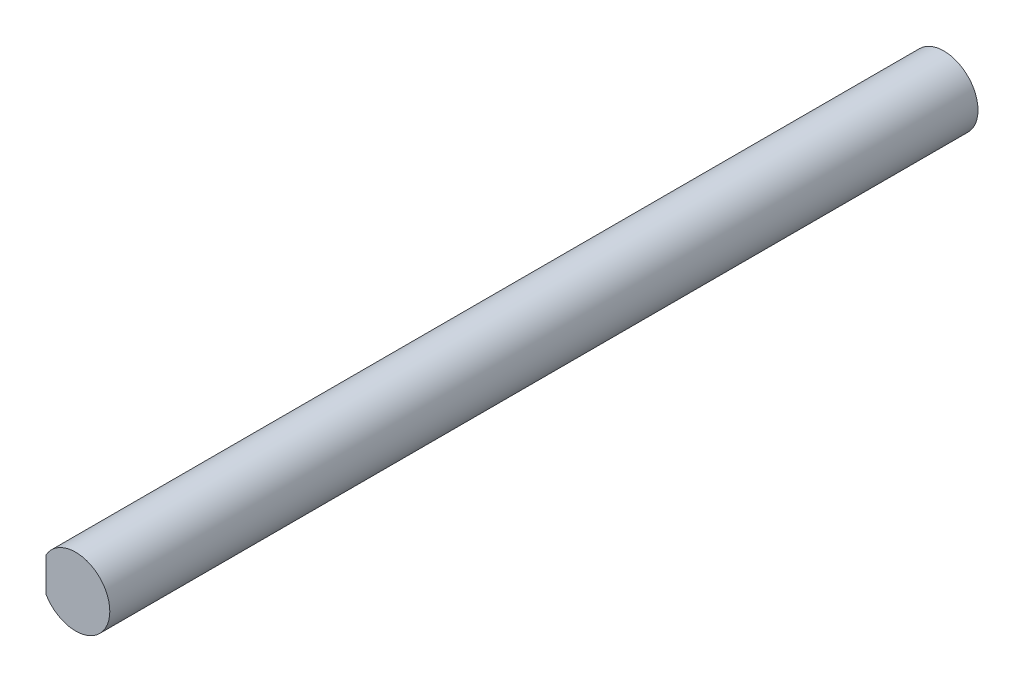
from build123d import *

# Parameters (mm, degrees)
BOSS_EXTRUDE1_DEPTH = 76.2


with BuildPart() as part:
    # Sketch1 → Boss-Extrude1 (new body)
    with BuildSketch(Plane.XY):
        with BuildLine():
            Line((-2.599999976, 0), (-2.599999976, 1.496662996))
            ThreePointArc((-2.599999976, 1.496662996), (3, 0), (-2.599999976, -1.496662996))
            Line((-2.599999976, -1.496662996), (-2.599999976, 0))
        make_face()
    extrude(amount=BOSS_EXTRUDE1_DEPTH)


solid = part.part
